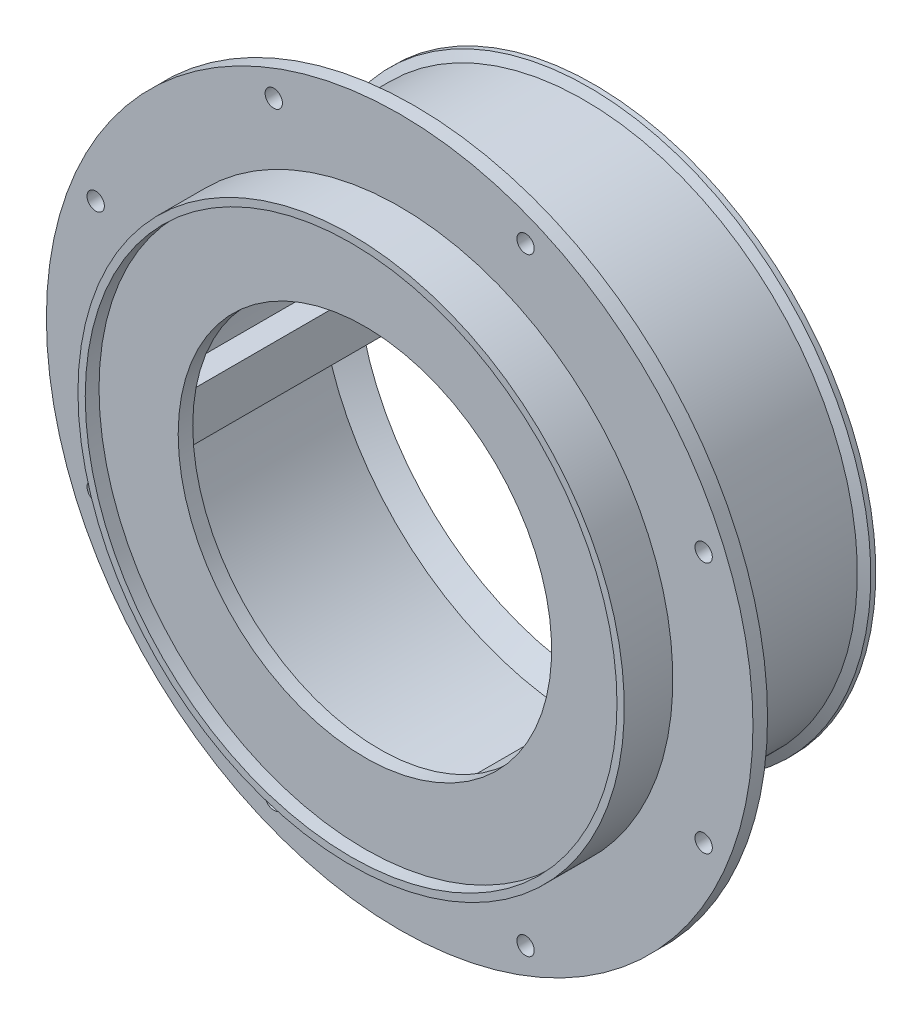
from build123d import *

# Parameters (mm, degrees)
HOLE_WIZARD_1_4_1_D      = 7.14248
PATTERN_CIRCULAR_1_COUNT = 4
SKETCH_6_W               = 10
SKETCH_6_H               = 20
EXTRUDE_1_DEPTH          = 85
SKETCH_7_W               = 50
SKETCH_7_H               = 20
EXTRUDE_2_DEPTH          = 5


with BuildPart() as part:
    # ｽｹｯﾁ1 → 回転1 (revolve)
    with BuildSketch(Plane(origin=(0, 0, 0), x_dir=(1, 0, 0), z_dir=(0, 1, 0))):
        Polygon((111.732704886, 39.491362749), (116.090992439, 39.491362749), (116.090992439, 37.435413944), (112.5, 35.478273614), (112.5, -34.508637251), (145.5, -34.508637251), (145.5, -40.508637251), (112.5, -40.508637251), (112.5, -60.508637251), (109.5, -60.508637251), (109.5, -54.831811372), (76.899138585, -54.831811372), (76.899138585, -48.831811372), (109.5, -48.831811372), (109.5, 35.478273614), (101.192673018, 42.998947767), (107.858230993, 42.998947767), align=None)
    revolve(axis=Axis((0, 0, -66.031649095), (0, 0, 1)))

    # 1/4 すきま穴1 (through all)
    with Locations(Plane(origin=(-125.185676655, 51.853605085, 34.508637251), x_dir=(-1, 0, 0), z_dir=(0, 0, -1))):
        with Locations((0, 0), (0, -103.70721017)):
            hole_wizard_1_4_1 = Hole(HOLE_WIZARD_1_4_1_D / 2)

    # 円形ﾊﾟﾀｰﾝ1: 1/4 すきま穴1 ×4 about axis
    pattern_circular_1_axis = Axis((0, 0, -74.086098759), (0, 0, 1))
    for i in range(1, PATTERN_CIRCULAR_1_COUNT):
        add(hole_wizard_1_4_1.rotate(pattern_circular_1_axis, i * 360 / PATTERN_CIRCULAR_1_COUNT), mode=Mode.SUBTRACT)

    # ｽｹｯﾁ6 → ﾎﾞｽ - 押し出し1 (add)
    with BuildSketch(Plane(origin=(0, 0, 48.831811372), x_dir=(-1, 0, 0), z_dir=(0, 0, -1))):
        Polygon((-31.397465716, -74.248707787), (-36.397465716, -82.908961825), (-53.717973792, -72.908961825), (-48.717973792, -64.248707787), align=None)
        with Locations((85, -0.066649031)):
            Rectangle(SKETCH_6_W, SKETCH_6_H)
        Polygon((-48.602534284, 64.315356818), (-53.602534284, 72.975610856), (-36.282026208, 82.975610856), (-31.282026208, 74.315356818), align=None)
    extrude(amount=EXTRUDE_1_DEPTH)

    # ｽｹｯﾁ7 → ﾎﾞｽ - 押し出し2 (add)
    with BuildSketch(Plane(origin=(0, 0, -36.168188628), x_dir=(-1, 0, 0), z_dir=(0, 0, -1))):
        Polygon((-11.397465716, -39.607691636), (-36.397465716, -82.908961825), (-53.717973792, -72.908961825), (-28.717973792, -29.607691636), align=None)
        with Locations((65, -0.066649031)):
            Rectangle(SKETCH_7_W, SKETCH_7_H)
        Polygon((-28.602534284, 29.674340667), (-53.602534284, 72.975610856), (-36.282026208, 82.975610856), (-11.282026208, 39.674340667), align=None)
    extrude(amount=EXTRUDE_2_DEPTH)


solid = part.part
